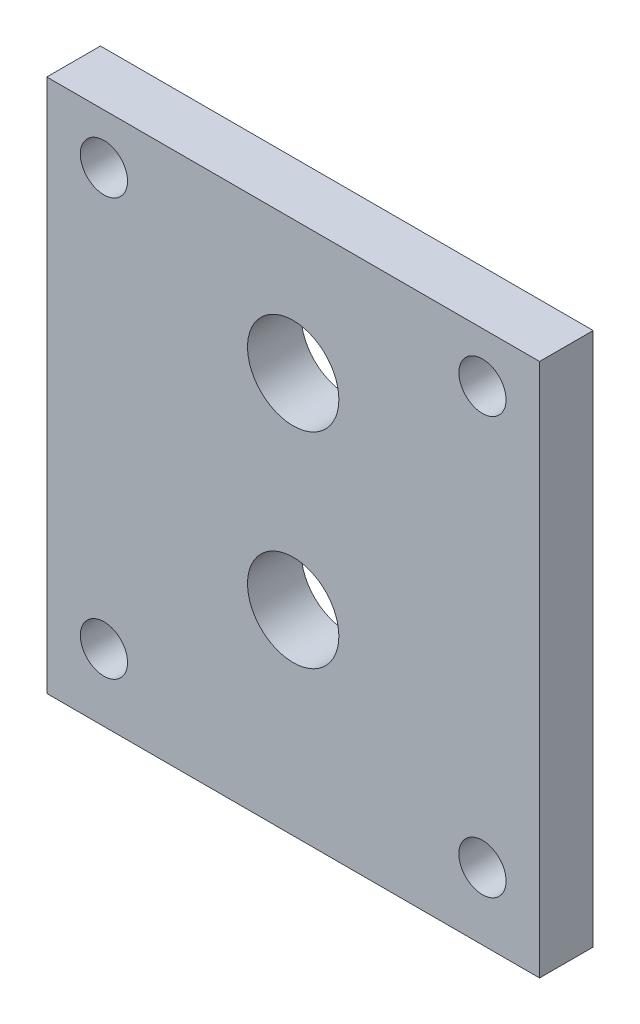
from build123d import *

# Parameters (mm, degrees)
SKETCH1_W           = 29.182779401
SKETCH1_H           = 31.619740081
SKETCH1_R           = 1.397
SKETCH1_R_2         = 2.704093878
SKETCH1_R_3         = 2.704093906
BOSS_EXTRUDE1_DEPTH = 3.175


with BuildPart() as part:
    # Sketch1 → Boss-Extrude1 (new body)
    with BuildSketch(Plane.XY):
        with Locations((14.428631608, -13.273961345)):
            Rectangle(SKETCH1_W, SKETCH1_H)
        with Locations((3.220865479, -0.422913296)):
            Circle(SKETCH1_R, mode=Mode.SUBTRACT)
        with Locations((25.636397737, -0.422913296)):
            Circle(SKETCH1_R, mode=Mode.SUBTRACT)
        with Locations((25.636397737, -25.106684096)):
            Circle(SKETCH1_R, mode=Mode.SUBTRACT)
        with Locations((3.220865479, -25.106684096)):
            Circle(SKETCH1_R, mode=Mode.SUBTRACT)
        with Locations((14.428631608, -5.359667456)):
            Circle(SKETCH1_R_2, mode=Mode.SUBTRACT)
        with Locations((14.428631608, -17.501414064)):
            Circle(SKETCH1_R_3, mode=Mode.SUBTRACT)
    extrude(amount=BOSS_EXTRUDE1_DEPTH)


solid = part.part
